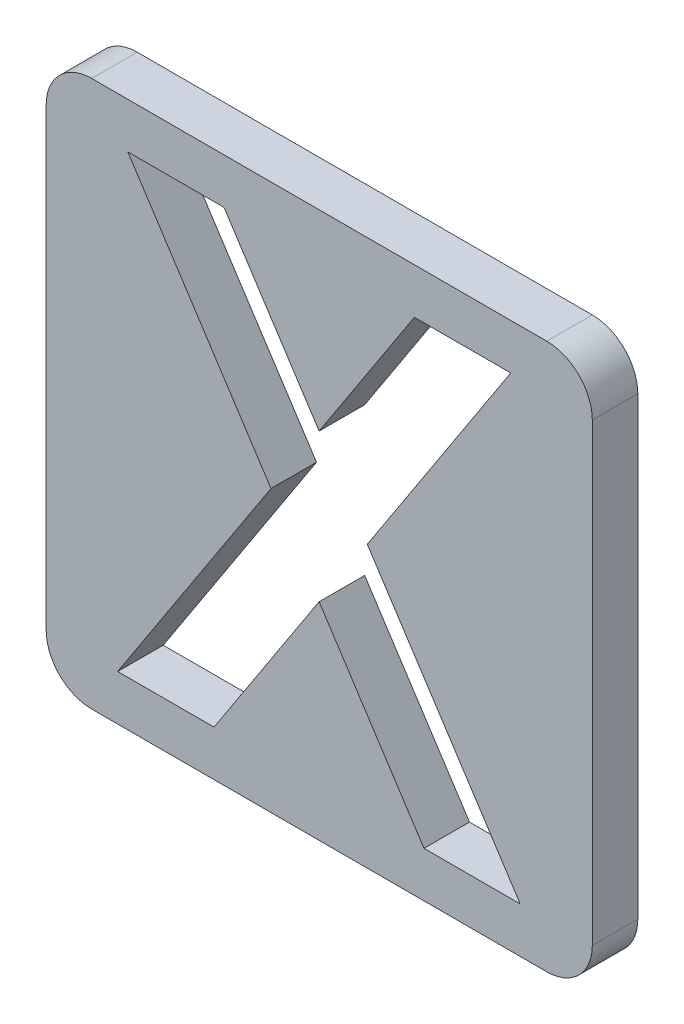
from build123d import *

# Parameters (mm, degrees)
BOSS_EXTRUDE1_DEPTH = 10
CUT_EXTRUDE37_DEPTH = 10


with BuildPart() as part:
    # Sketch1 → Boss-Extrude1 (new body)
    with BuildSketch(Plane.XY):
        with BuildLine():
            Line((-50, 60), (50, 60))
            ThreePointArc((50, 60), (57.071067812, 57.071067812), (60, 50))
            Line((60, 50), (60, -50))
            ThreePointArc((60, -50), (57.071067812, -57.071067812), (50, -60))
            Line((50, -60), (-50, -60))
            ThreePointArc((-50, -60), (-57.071067812, -57.071067812), (-60, -50))
            Line((-60, -50), (-60, 50))
            ThreePointArc((-60, 50), (-57.071067812, 57.071067812), (-50, 60))
        make_face()
    extrude(amount=BOSS_EXTRUDE1_DEPTH)

    # Sketch2 → Cut-Extrude37 (cut)
    with BuildSketch(Plane.XY.offset(10)):
        Polygon((-42.071314103, 50), (-20.917467949, 50), (-0.024038462, 17.888621795), (20.909455128, 50), (42.083333333, 50), (10.552884615, 1.642628205), (44.166666667, -50), (23.012820513, -50), (-0.024038462, -14.583333333), (-23.12099359, -50), (-44.294871795, -50), (-10.600961538, 1.662660256), align=None)
    extrude(amount=-CUT_EXTRUDE37_DEPTH, mode=Mode.SUBTRACT)


solid = part.part
